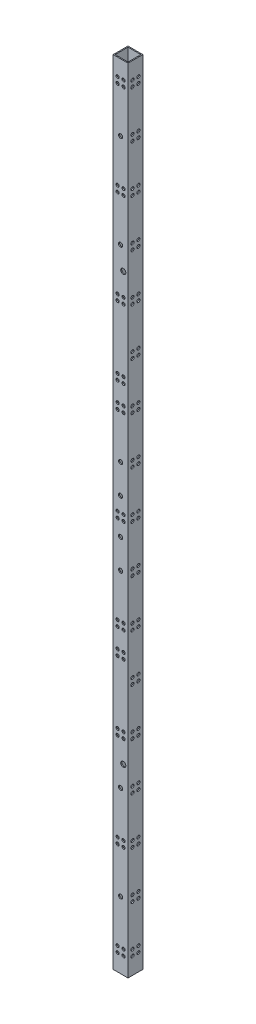
from build123d import *

# Parameters (mm, degrees)
SKETCH_1_W          = 15
SKETCH_1_H          = 15
SKETCH_1_W_2        = 13
SKETCH_1_H_2        = 13
EXTRUDE_1_DEPTH     = 800
SKETCH_2_R          = 1.6
SKETCH_2_R_2        = 2.1
SKETCH_2_R_3        = 2.6
CUT_EXTRUDE_1_DEPTH = 15
SKETCH_3_R          = 1.6
CUT_EXTRUDE_2_DEPTH = 15


with BuildPart() as part:
    # 草图1 → 凸台-拉伸1 (new body)
    with BuildSketch(Plane(origin=(0, 0, 0), x_dir=(1, 0, 0), z_dir=(0, 1, 0))):
        Rectangle(SKETCH_1_W, SKETCH_1_H)
        Rectangle(SKETCH_1_W_2, SKETCH_1_H_2, mode=Mode.SUBTRACT)
    extrude(amount=EXTRUDE_1_DEPTH)

    # 草图2 → 切除-拉伸1 (cut)
    with BuildSketch(Plane.XY.offset(7.5)):
        with Locations((-3, 783)):
            Circle(SKETCH_2_R)
        with Locations((3, 783)):
            Circle(SKETCH_2_R)
        with Locations((-3, 777)):
            Circle(SKETCH_2_R)
        with Locations((3, 777)):
            Circle(SKETCH_2_R)
        with Locations((3, 23)):
            Circle(SKETCH_2_R)
        with Locations((-3, 23)):
            Circle(SKETCH_2_R)
        with Locations((3, 17)):
            Circle(SKETCH_2_R)
        with Locations((-3, 17)):
            Circle(SKETCH_2_R)
        with Locations((0, 418)):
            Circle(SKETCH_2_R_2)
        with Locations((0, 382)):
            Circle(SKETCH_2_R_2)
        with Locations((3, 118)):
            Circle(SKETCH_2_R)
        with Locations((-3, 118)):
            Circle(SKETCH_2_R)
        with Locations((-3, 112)):
            Circle(SKETCH_2_R)
        with Locations((3, 112)):
            Circle(SKETCH_2_R)
        with Locations((3, 213)):
            Circle(SKETCH_2_R)
        with Locations((-3, 213)):
            Circle(SKETCH_2_R)
        with Locations((-3, 207)):
            Circle(SKETCH_2_R)
        with Locations((3, 207)):
            Circle(SKETCH_2_R)
        with Locations((3, 308)):
            Circle(SKETCH_2_R)
        with Locations((-3, 308)):
            Circle(SKETCH_2_R)
        with Locations((-3, 302)):
            Circle(SKETCH_2_R)
        with Locations((3, 302)):
            Circle(SKETCH_2_R)
        with Locations((3, 403)):
            Circle(SKETCH_2_R)
        with Locations((-3, 403)):
            Circle(SKETCH_2_R)
        with Locations((-3, 397)):
            Circle(SKETCH_2_R)
        with Locations((3, 397)):
            Circle(SKETCH_2_R)
        with Locations((3, 498)):
            Circle(SKETCH_2_R)
        with Locations((-3, 498)):
            Circle(SKETCH_2_R)
        with Locations((-3, 492)):
            Circle(SKETCH_2_R)
        with Locations((3, 492)):
            Circle(SKETCH_2_R)
        with Locations((3, 593)):
            Circle(SKETCH_2_R)
        with Locations((-3, 593)):
            Circle(SKETCH_2_R)
        with Locations((-3, 587)):
            Circle(SKETCH_2_R)
        with Locations((3, 587)):
            Circle(SKETCH_2_R)
        with Locations((3, 688)):
            Circle(SKETCH_2_R)
        with Locations((-3, 688)):
            Circle(SKETCH_2_R)
        with Locations((-3, 682)):
            Circle(SKETCH_2_R)
        with Locations((3, 682)):
            Circle(SKETCH_2_R)
        with Locations((0, 732.5)):
            Circle(SKETCH_2_R_2)
        with Locations((0, 637.5)):
            Circle(SKETCH_2_R_2)
        with Locations((0, 447.5)):
            Circle(SKETCH_2_R_2)
        with Locations((0, 352.5)):
            Circle(SKETCH_2_R_2)
        with Locations((0, 162.5)):
            Circle(SKETCH_2_R_2)
        with Locations((0, 67.5)):
            Circle(SKETCH_2_R_2)
        with Locations((2.75, 615.5)):
            Circle(SKETCH_2_R_3)
        with Locations((-3, 523.5)):
            Circle(SKETCH_2_R)
        with Locations((3, 523.5)):
            Circle(SKETCH_2_R)
        with Locations((3, 517.5)):
            Circle(SKETCH_2_R)
        with Locations((-3, 517.5)):
            Circle(SKETCH_2_R)
        with Locations((-3, 282.5)):
            Circle(SKETCH_2_R)
        with Locations((3, 282.5)):
            Circle(SKETCH_2_R)
        with Locations((3, 276.5)):
            Circle(SKETCH_2_R)
        with Locations((-3, 276.5)):
            Circle(SKETCH_2_R)
        with Locations((2.75, 184.5)):
            Circle(SKETCH_2_R_3)
    extrude(amount=-CUT_EXTRUDE_1_DEPTH, mode=Mode.SUBTRACT)

    # 草图3 → 切除-拉伸2 (cut)
    with BuildSketch(Plane.ZY.offset(7.5)):
        with Locations((-3, 783)):
            Circle(SKETCH_3_R)
        with Locations((3, 783)):
            Circle(SKETCH_3_R)
        with Locations((-3, 777)):
            Circle(SKETCH_3_R)
        with Locations((3, 777)):
            Circle(SKETCH_3_R)
        with Locations((-3, 735.5)):
            Circle(SKETCH_3_R)
        with Locations((-3, 729.5)):
            Circle(SKETCH_3_R)
        with Locations((3, 729.5)):
            Circle(SKETCH_3_R)
        with Locations((3, 735.5)):
            Circle(SKETCH_3_R)
        with Locations((-3, 688)):
            Circle(SKETCH_3_R)
        with Locations((-3, 682)):
            Circle(SKETCH_3_R)
        with Locations((3, 682)):
            Circle(SKETCH_3_R)
        with Locations((3, 688)):
            Circle(SKETCH_3_R)
        with Locations((-3, 640.5)):
            Circle(SKETCH_3_R)
        with Locations((-3, 634.5)):
            Circle(SKETCH_3_R)
        with Locations((3, 634.5)):
            Circle(SKETCH_3_R)
        with Locations((3, 640.5)):
            Circle(SKETCH_3_R)
        with Locations((-3, 593)):
            Circle(SKETCH_3_R)
        with Locations((-3, 587)):
            Circle(SKETCH_3_R)
        with Locations((3, 587)):
            Circle(SKETCH_3_R)
        with Locations((3, 593)):
            Circle(SKETCH_3_R)
        with Locations((-3, 545.5)):
            Circle(SKETCH_3_R)
        with Locations((-3, 539.5)):
            Circle(SKETCH_3_R)
        with Locations((3, 539.5)):
            Circle(SKETCH_3_R)
        with Locations((3, 545.5)):
            Circle(SKETCH_3_R)
        with Locations((-3, 498)):
            Circle(SKETCH_3_R)
        with Locations((-3, 492)):
            Circle(SKETCH_3_R)
        with Locations((3, 492)):
            Circle(SKETCH_3_R)
        with Locations((3, 498)):
            Circle(SKETCH_3_R)
        with Locations((-3, 450.5)):
            Circle(SKETCH_3_R)
        with Locations((-3, 444.5)):
            Circle(SKETCH_3_R)
        with Locations((3, 444.5)):
            Circle(SKETCH_3_R)
        with Locations((3, 450.5)):
            Circle(SKETCH_3_R)
        with Locations((-3, 403)):
            Circle(SKETCH_3_R)
        with Locations((-3, 397)):
            Circle(SKETCH_3_R)
        with Locations((3, 397)):
            Circle(SKETCH_3_R)
        with Locations((3, 403)):
            Circle(SKETCH_3_R)
        with Locations((-3, 355.5)):
            Circle(SKETCH_3_R)
        with Locations((-3, 349.5)):
            Circle(SKETCH_3_R)
        with Locations((3, 349.5)):
            Circle(SKETCH_3_R)
        with Locations((3, 355.5)):
            Circle(SKETCH_3_R)
        with Locations((-3, 308)):
            Circle(SKETCH_3_R)
        with Locations((-3, 302)):
            Circle(SKETCH_3_R)
        with Locations((3, 302)):
            Circle(SKETCH_3_R)
        with Locations((3, 308)):
            Circle(SKETCH_3_R)
        with Locations((-3, 260.5)):
            Circle(SKETCH_3_R)
        with Locations((-3, 254.5)):
            Circle(SKETCH_3_R)
        with Locations((3, 254.5)):
            Circle(SKETCH_3_R)
        with Locations((3, 260.5)):
            Circle(SKETCH_3_R)
        with Locations((-3, 213)):
            Circle(SKETCH_3_R)
        with Locations((-3, 207)):
            Circle(SKETCH_3_R)
        with Locations((3, 207)):
            Circle(SKETCH_3_R)
        with Locations((3, 213)):
            Circle(SKETCH_3_R)
        with Locations((-3, 165.5)):
            Circle(SKETCH_3_R)
        with Locations((-3, 159.5)):
            Circle(SKETCH_3_R)
        with Locations((3, 159.5)):
            Circle(SKETCH_3_R)
        with Locations((3, 165.5)):
            Circle(SKETCH_3_R)
        with Locations((-3, 118)):
            Circle(SKETCH_3_R)
        with Locations((-3, 112)):
            Circle(SKETCH_3_R)
        with Locations((3, 112)):
            Circle(SKETCH_3_R)
        with Locations((3, 118)):
            Circle(SKETCH_3_R)
        with Locations((-3, 70.5)):
            Circle(SKETCH_3_R)
        with Locations((-3, 64.5)):
            Circle(SKETCH_3_R)
        with Locations((3, 64.5)):
            Circle(SKETCH_3_R)
        with Locations((3, 70.5)):
            Circle(SKETCH_3_R)
        with Locations((-3, 23)):
            Circle(SKETCH_3_R)
        with Locations((-3, 17)):
            Circle(SKETCH_3_R)
        with Locations((3, 17)):
            Circle(SKETCH_3_R)
        with Locations((3, 23)):
            Circle(SKETCH_3_R)
    extrude(amount=-CUT_EXTRUDE_2_DEPTH, mode=Mode.SUBTRACT)


solid = part.part
